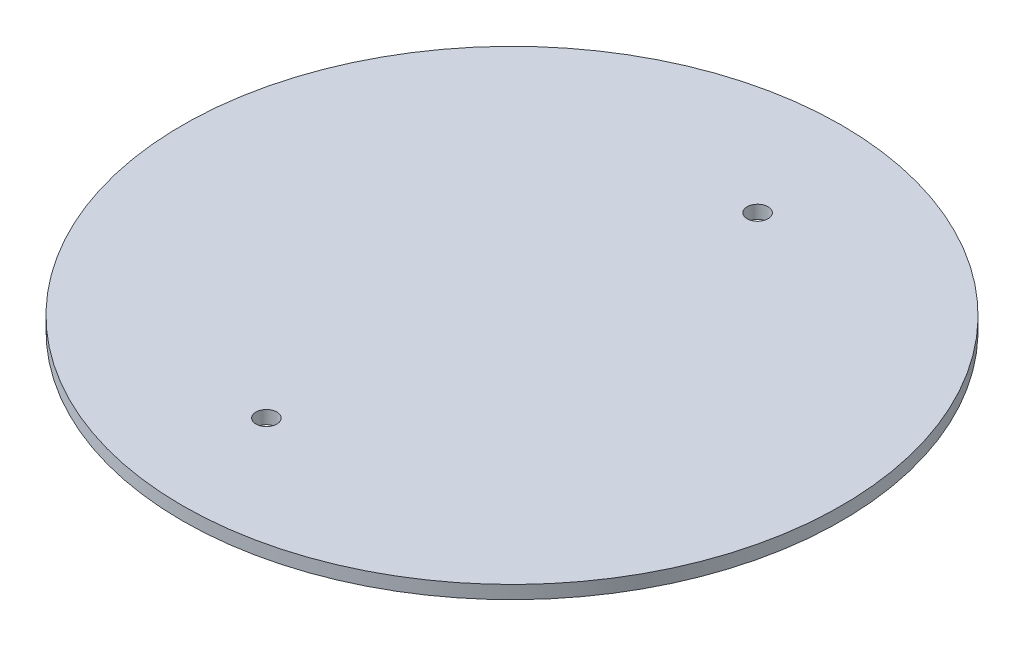
from build123d import *

# Parameters (mm, degrees)
SKETCH1_R   = 20
SKETCH1_R_2 = 0.635
PCB_DEPTH   = 0.8


with BuildPart() as part:
    # Sketch1 → PCB (new body)
    with BuildSketch(Plane(origin=(0, 0, 0), x_dir=(1, 0, 0), z_dir=(0, 1, 0))):
        with Locations(Location((0, 0, 0), (0, 0, 270))):
            Circle(SKETCH1_R)
        with Locations(Location((2.05801875, 12.846715625, 0), (0, 0, 270))):
            Circle(SKETCH1_R_2, mode=Mode.SUBTRACT)
        with Locations(Location((-2.05801875, -12.846715625, 0), (0, 0, 270))):
            Circle(SKETCH1_R_2, mode=Mode.SUBTRACT)
    extrude(amount=PCB_DEPTH)


solid = part.part
